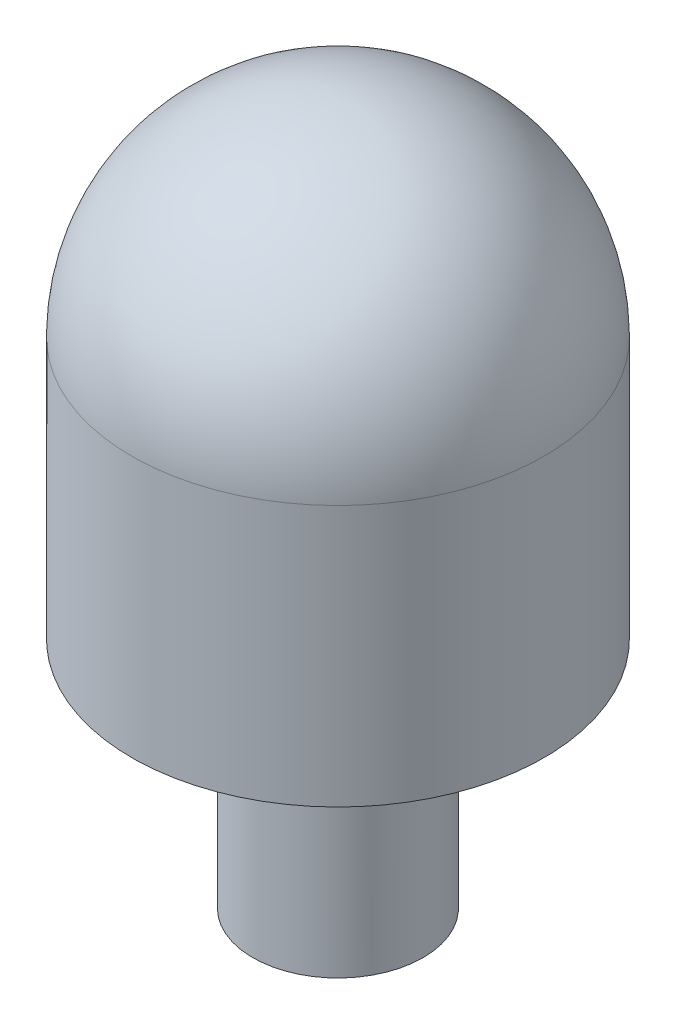
from build123d import *
from build123d.topology import SkipClean

# Parameters (mm, degrees)
CUT_EXTRUDE1_START  = -3
CUT_EXTRUDE1_DEPTH  = 3.2
CUT_EXTRUDE2_REACH  = 22.037
SKETCH3_R           = 2.1
BOSS_EXTRUDE1_START = 0.5
SKETCH4_R           = 3.1
SKETCH4_R_2         = 2.6
BOSS_EXTRUDE1_DEPTH = 8
BOSS_EXTRUDE2_REACH = 22.037


with BuildPart() as part:
    # Sketch1 → Revolve1 (revolve)
    with BuildSketch(Plane.XY):
        with BuildLine():
            Line((0, 0), (-7.5, 0))
            Line((-7.5, 0), (-7.5, 9.5))
            ThreePointArc((-7.5, 9.5), (-5.303300859, 14.803300859), (0, 17))
            Line((0, 17), (0, 0))
        make_face()
    revolve(axis=Axis((0, 17, 0), (0, -1, 0)))

    # Sketch2 → Cut-Extrude1 (cut)
    with BuildSketch(Plane.XZ.offset(CUT_EXTRUDE1_START)):
        Polygon((-2.136195996, 3.7), (-4.272391992, 0), (-2.136195996, -3.7), (2.136195996, -3.7), (4.272391992, 0), (2.136195996, 3.7), align=None)
    extrude(amount=-CUT_EXTRUDE1_DEPTH, mode=Mode.SUBTRACT)

    # Sketch3 → Cut-Extrude2 (cut, up to next)
    with BuildSketch(Plane.XZ, mode=Mode.PRIVATE) as cut_extrude2_sk1:
        Circle(SKETCH3_R)
    cut_extrude2_tool1 = extrude(cut_extrude2_sk1.sketch, amount=-CUT_EXTRUDE2_REACH, mode=Mode.PRIVATE) & part.part
    add(cut_extrude2_tool1.solids().sort_by_distance((0, 0, 0))[0], mode=Mode.SUBTRACT)


with BuildPart() as body_2:
    # Sketch4 → Boss-Extrude1 (new body)
    with BuildSketch(Plane.XZ.offset(BOSS_EXTRUDE1_START)):
        Circle(SKETCH4_R)
        Circle(SKETCH4_R_2, mode=Mode.SUBTRACT)
    extrude(amount=BOSS_EXTRUDE1_DEPTH)

    # Sketch5 → Boss-Extrude2 (add, up to next)
    with BuildSketch(Plane.XZ, mode=Mode.PRIVATE) as boss_extrude2_sk1:
        with BuildLine():
            Line((-0.25, 3.089902911), (-0.209677419, 2.591531474))
            ThreePointArc((-0.209677419, 2.591531474), (0, 2.6), (0.209677419, 2.591531474))
            Line((0.209677419, 2.591531474), (0.25, 3.089902911))
            ThreePointArc((0.25, 3.089902911), (0, 3.1), (-0.25, 3.089902911))
        make_face()
    boss_extrude2_tool1 = extrude(boss_extrude2_sk1.sketch, amount=BOSS_EXTRUDE2_REACH, mode=Mode.PRIVATE) - body_2.part
    # Sketch5 → Boss-Extrude2 (add, up to next)
    with BuildSketch(Plane.XZ, mode=Mode.PRIVATE) as boss_extrude2_sk2:
        with BuildLine():
            Line((2.591531474, -0.209677419), (3.089902911, -0.25))
            ThreePointArc((3.089902911, -0.25), (3.1, 0), (3.089902911, 0.25))
            Line((3.089902911, 0.25), (2.591531474, 0.209677419))
            ThreePointArc((2.591531474, 0.209677419), (2.6, 0), (2.591531474, -0.209677419))
        make_face()
    boss_extrude2_tool2 = extrude(boss_extrude2_sk2.sketch, amount=BOSS_EXTRUDE2_REACH, mode=Mode.PRIVATE) - body_2.part
    # Sketch5 → Boss-Extrude2 (add, up to next)
    with BuildSketch(Plane.XZ, mode=Mode.PRIVATE) as boss_extrude2_sk3:
        with BuildLine():
            Line((-0.209677419, -2.591531474), (-0.25, -3.089902911))
            ThreePointArc((-0.25, -3.089902911), (0, -3.1), (0.25, -3.089902911))
            Line((0.25, -3.089902911), (0.209677419, -2.591531474))
            ThreePointArc((0.209677419, -2.591531474), (0, -2.6), (-0.209677419, -2.591531474))
        make_face()
    boss_extrude2_tool3 = extrude(boss_extrude2_sk3.sketch, amount=BOSS_EXTRUDE2_REACH, mode=Mode.PRIVATE) - body_2.part
    # Sketch5 → Boss-Extrude2 (add, up to next)
    with BuildSketch(Plane.XZ, mode=Mode.PRIVATE) as boss_extrude2_sk4:
        with BuildLine():
            Line((-2.591531474, 0.209677419), (-3.089902911, 0.25))
            ThreePointArc((-3.089902911, 0.25), (-3.1, 0), (-3.089902911, -0.25))
            Line((-3.089902911, -0.25), (-2.591531474, -0.209677419))
            ThreePointArc((-2.591531474, -0.209677419), (-2.6, 0), (-2.591531474, 0.209677419))
        make_face()
    boss_extrude2_tool4 = extrude(boss_extrude2_sk4.sketch, amount=BOSS_EXTRUDE2_REACH, mode=Mode.PRIVATE) - body_2.part

    add(part.part)  # Boss-Extrude2 merges part
    add(boss_extrude2_tool1.solids().sort_by_distance((0, 0, 2.854207))[0])
    add(boss_extrude2_tool2.solids().sort_by_distance((2.854207, 0, 0))[0])
    add(boss_extrude2_tool3.solids().sort_by_distance((0, 0, -2.854207))[0])
    add(boss_extrude2_tool4.solids().sort_by_distance((-2.854207, 0, 0))[0])


solid = body_2.part
